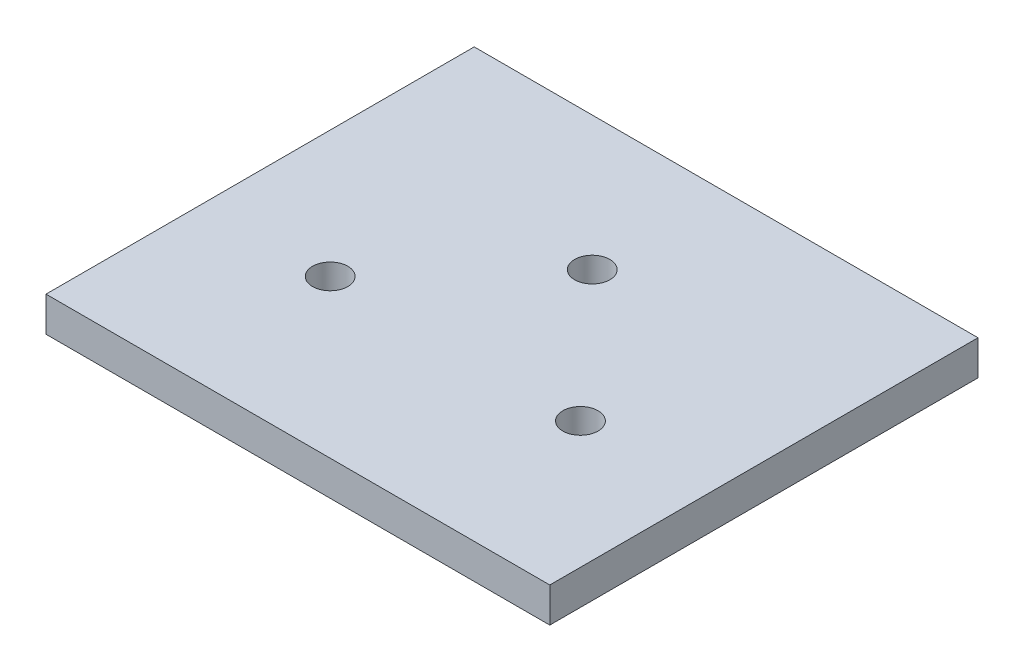
from build123d import *

# Parameters (mm, degrees)
SKETCH1_W           = 100
SKETCH1_H           = 85
SKETCH1_R           = 3.5
BOSS_EXTRUDE1_DEPTH = 6.9


with BuildPart() as part:
    # Sketch1 → Boss-Extrude1 (new body)
    with BuildSketch(Plane(origin=(0, 0, 0), x_dir=(1, 0, 0), z_dir=(0, 1, 0))):
        with Locations((0, 42.5)):
            Rectangle(SKETCH1_W, SKETCH1_H)
        with Locations(Location((0, 58.429171706, 0), (0, 0, 90))):
            Circle(SKETCH1_R, mode=Mode.SUBTRACT)
        with Locations(Location((24.839585853, 31.25, 0), (0, 0, 90))):
            Circle(SKETCH1_R, mode=Mode.SUBTRACT)
        with Locations(Location((-24.839585853, 31.25, 0), (0, 0, 90))):
            Circle(SKETCH1_R, mode=Mode.SUBTRACT)
    extrude(amount=BOSS_EXTRUDE1_DEPTH)


solid = part.part
